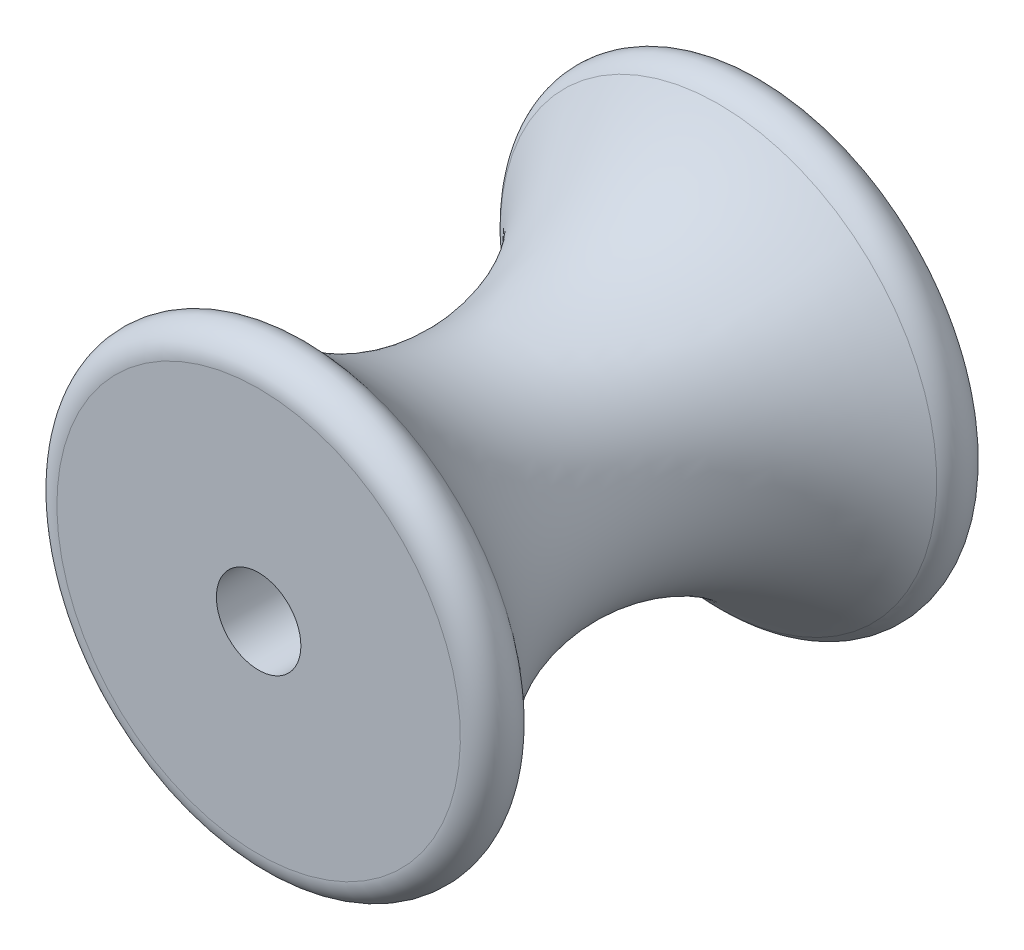
from build123d import *

# Parameters (mm, degrees)
FILLET1_R = 1


with BuildPart() as part:
    # Sketch1 → Revolve1 (revolve)
    with BuildSketch(Plane(origin=(0, 0, 0), x_dir=(0, 0, -1), z_dir=(1, 0, 0))):
        with BuildLine():
            Line((9.6, 1.6), (9.6, 11.7))
            ThreePointArc((9.6, 11.7), (0, 4.5), (-9.6, 11.7))
            Line((-9.6, 11.7), (-9.6, 1.6))
            Line((-9.6, 1.6), (9.6, 1.6))
        make_face()
    revolve(axis=Axis((0, 0, -10), (0, 0, 1)))

    # Fillet1
    fillet1_edges = [part.edges().sort_by_distance(p)[0] for p in [
        (0, -11.7, 9.6),
        (0, -11.7, -9.6),
    ]]
    fillet(fillet1_edges, radius=FILLET1_R)


solid = part.part
